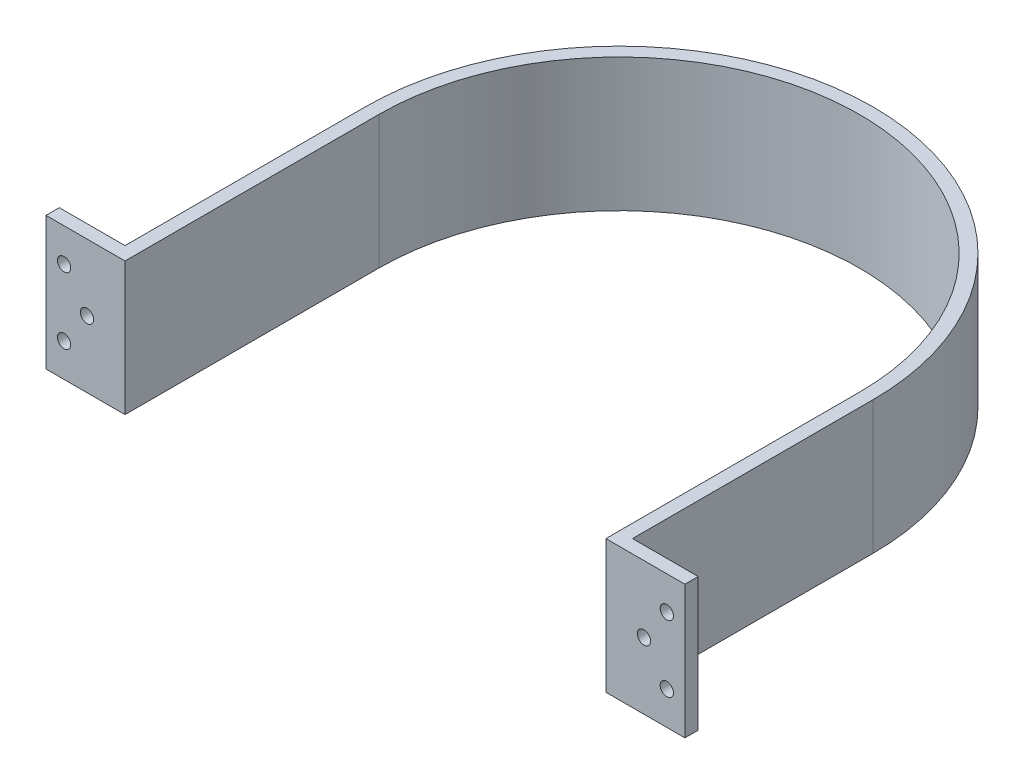
from build123d import *

# Parameters (mm, degrees)
BOSS_EXTRUDE1_DEPTH = 31.75
SKETCH15_R          = 3.175
CUT_EXTRUDE1_DEPTH  = 288.83021471


with BuildPart() as part:
    # Sketch1 → Boss-Extrude1 (new, symmetric)
    with BuildSketch(Plane(origin=(0, 0, 0), x_dir=(1, 0, 0), z_dir=(0, 1, 0))):
        with BuildLine():
            Line((-114.7, -121.05), (-114.7, 0))
            ThreePointArc((-114.7, 0), (0, 114.7), (114.7, 0))
            Line((114.7, 0), (114.7, -121.05))
            Line((114.7, -121.05), (152.4, -121.05))
            Line((152.4, -121.05), (152.4, -114.7))
            Line((152.4, -114.7), (121.05, -114.7))
            Line((121.05, -114.7), (121.05, 0))
            ThreePointArc((121.05, 0), (0, 121.05), (-121.05, 0))
            Line((-121.05, 0), (-121.05, -12.7))
            Line((-121.05, -12.7), (-121.05, -114.7))
            Line((-121.05, -114.7), (-152.4, -114.7))
            Line((-152.4, -114.7), (-152.4, -121.05))
            Line((-152.4, -121.05), (-114.7, -121.05))
        make_face()
    extrude(amount=BOSS_EXTRUDE1_DEPTH, both=True)

    # Sketch15 → Cut-Extrude1 (cut, through all)
    with BuildSketch(Plane.XY.offset(121.05)):
        with Locations((-143.76875, 15.875)):
            Circle(SKETCH15_R)
        with Locations((-143.76875, -15.875)):
            Circle(SKETCH15_R)
        with Locations((-132.85625, 0)):
            Circle(SKETCH15_R)
        with Locations(Location((132.85625, 0, 0), (0, 0, 180))):
            Circle(SKETCH15_R)
        with Locations((143.76875, -15.875)):
            Circle(SKETCH15_R)
        with Locations(Location((143.76875, 15.875, 0), (0, 0, 180))):
            Circle(SKETCH15_R)
    extrude(amount=-CUT_EXTRUDE1_DEPTH, mode=Mode.SUBTRACT)


solid = part.part
